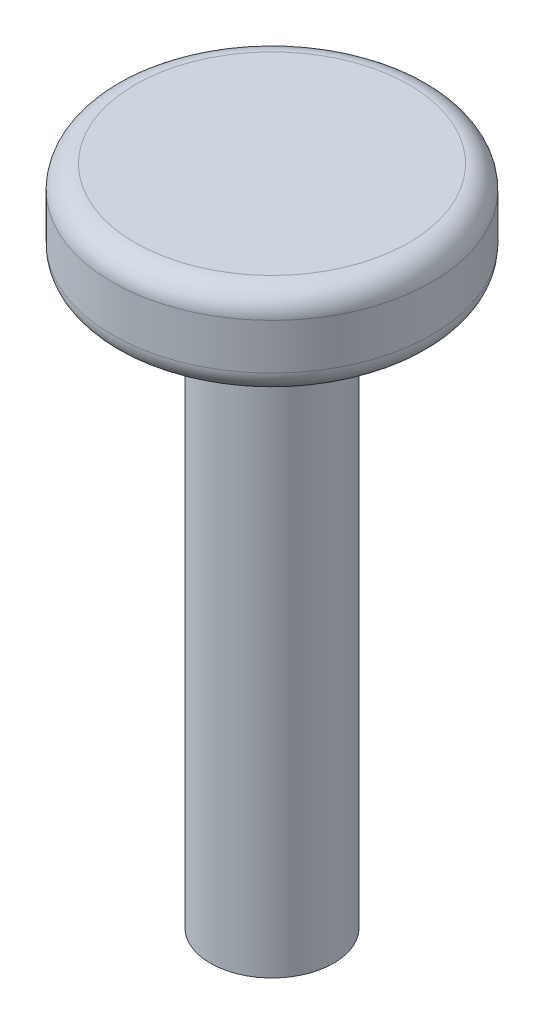
from build123d import *

# Parameters (mm, degrees)
SKETCH1_R           = 1.35
BOSS_EXTRUDE1_DEPTH = 12.5
SKETCH2_R           = 3.5
BOSS_EXTRUDE2_DEPTH = 2
FILLET1_R           = 0.5


with BuildPart() as part:
    # Sketch1 → Boss-Extrude1 (new body)
    with BuildSketch(Plane(origin=(0, 0, 0), x_dir=(1, 0, 0), z_dir=(0, 1, 0))):
        with Locations(Location((0, 0, 0), (0, 0, 270))):
            Circle(SKETCH1_R)
    extrude(amount=BOSS_EXTRUDE1_DEPTH)

    # Sketch2 → Boss-Extrude2 (add)
    with BuildSketch(Plane(origin=(0, 12.5, 0), x_dir=(1, 0, 0), z_dir=(0, 1, 0))):
        with Locations(Location((0, 0, 0), (0, 0, 270))):
            Circle(SKETCH2_R)
    extrude(amount=BOSS_EXTRUDE2_DEPTH)

    # Fillet1
    fillet1_edges = [part.edges().sort_by_distance(p)[0] for p in [
        (0, 12.5, -3.5),
        (0, 14.5, -3.5),
    ]]
    fillet(fillet1_edges, radius=FILLET1_R)


solid = part.part
